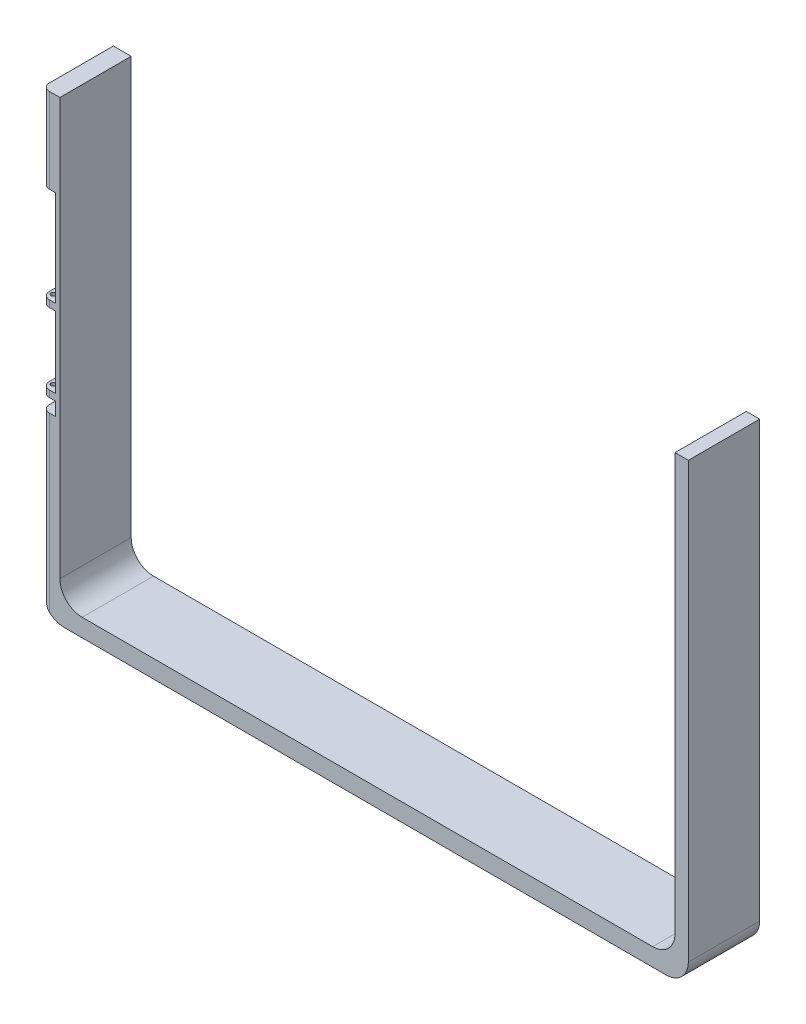
from build123d import *

# Parameters (mm, degrees)
EXTRUDE_1_DEPTH     = 32
SKETCH_2_R          = 2.1
CUT_EXTRUDE_1_DEPTH = 5
SKETCH_3_W          = 6
SKETCH_3_H          = 6
SKETCH_3_H_2        = 32
SKETCH_3_H_3        = 43
CUT_EXTRUDE_2_DEPTH = 6
SKETCH_4_R          = 1
CUT_EXTRUDE_3_DEPTH = 38
CUT_EXTRUDE_4_DEPTH = 289.729583292


with BuildPart() as part:
    # 草图1 → 凸台-拉伸1 (new body)
    with BuildSketch(Plane.XY):
        with BuildLine():
            Line((194.787878788, 116.363636364), (200.787878788, 116.363636364))
            Line((200.787878788, 116.363636364), (200.787878788, -78.636363636))
            ThreePointArc((200.787878788, -78.636363636), (197.8589466, -85.707431448), (190.787878788, -88.636363636))
            Line((190.787878788, -88.636363636), (-79.212121212, -88.636363636))
            ThreePointArc((-79.212121212, -88.636363636), (-86.283189024, -85.707431448), (-89.212121212, -78.636363636))
            Line((-89.212121212, -78.636363636), (-89.212121212, 116.363636364))
            Line((-89.212121212, 116.363636364), (-81.212121212, 116.363636364))
            Line((-81.212121212, 116.363636364), (-81.212121212, -70.636363636))
            ThreePointArc((-81.212121212, -70.636363636), (-78.283189024, -77.707431448), (-71.212121212, -80.636363636))
            Line((-71.212121212, -80.636363636), (184.787878788, -80.636363636))
            ThreePointArc((184.787878788, -80.636363636), (191.8589466, -77.707431448), (194.787878788, -70.636363636))
            Line((194.787878788, -70.636363636), (194.787878788, 116.363636364))
        make_face()
    extrude(amount=EXTRUDE_1_DEPTH)

    # 草图2 → 切除-拉伸1 (cut)
    with BuildSketch(Plane(origin=(0, 0, 0), x_dir=(-1, 0, 0), z_dir=(0, 0, -1))):
        with Locations((-182.787878788, -84.636363636)):
            Circle(SKETCH_2_R)
        with Locations((-55.787878788, -84.636363636)):
            Circle(SKETCH_2_R)
        with Locations((71.212121212, -84.636363636)):
            Circle(SKETCH_2_R)
    extrude(amount=-CUT_EXTRUDE_1_DEPTH, mode=Mode.SUBTRACT)

    # 草图3 → 切除-拉伸2 (cut)
    with BuildSketch(Plane.ZY.offset(89.212121212)):
        with Locations((29, -5.636363636)):
            Rectangle(SKETCH_3_W, SKETCH_3_H)
        with Locations((29, 16.363636364)):
            Rectangle(SKETCH_3_W, SKETCH_3_H_2)
        with Locations((29, 56.863636364)):
            Rectangle(SKETCH_3_W, SKETCH_3_H_3)
    extrude(amount=-CUT_EXTRUDE_2_DEPTH, mode=Mode.SUBTRACT)

    # 草图4 → 切除-拉伸3 (cut)
    with BuildSketch(Plane(origin=(0, 35.363636364, 0), x_dir=(1, 0, 0), z_dir=(0, 1, 0))):
        with Locations(Location((-87.212121212, -29, 0), (0, 0, 270))):
            Circle(SKETCH_4_R)
    extrude(amount=-CUT_EXTRUDE_3_DEPTH, mode=Mode.SUBTRACT)

    # 草图6 → 切除-拉伸4 (cut, through all)
    with BuildSketch(Plane.XZ.offset(88.636363636)):
        with BuildLine():
            Line((-89.212121212, 32), (-85.912121212, 32))
            ThreePointArc((-85.912121212, 32), (-88.24557359, 31.033452378), (-89.212121212, 28.7))
            Line((-89.212121212, 28.7), (-89.212121212, 32))
        make_face()
    extrude(amount=-CUT_EXTRUDE_4_DEPTH, mode=Mode.SUBTRACT)


solid = part.part
